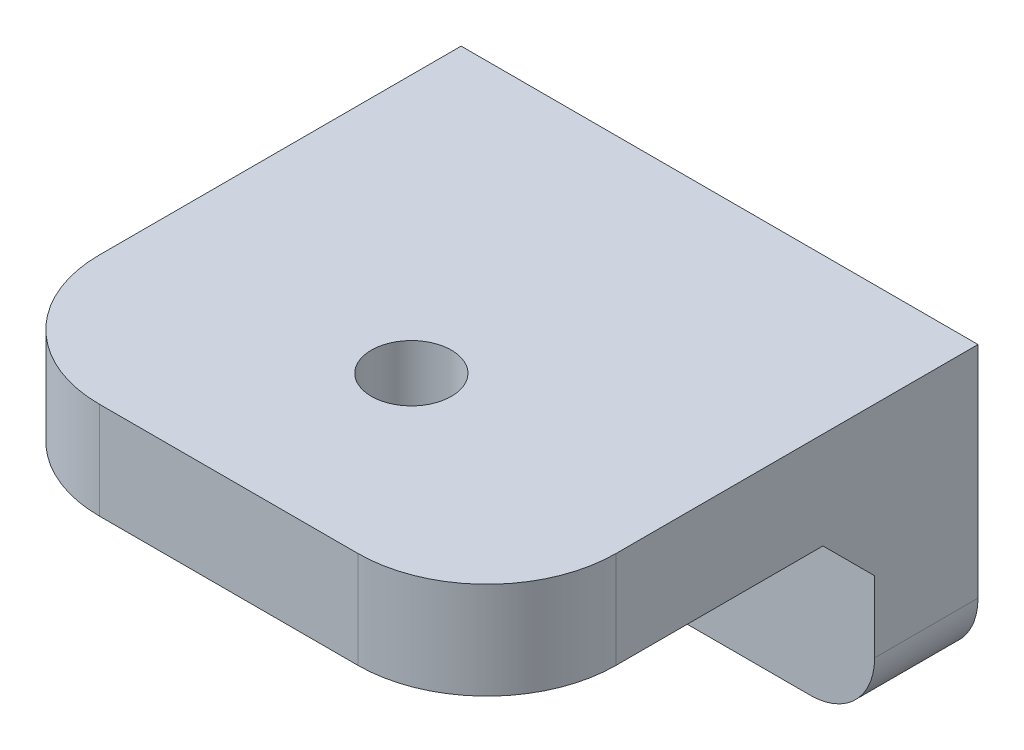
from build123d import *

# Parameters (mm, degrees)
SKETCH1_W           = 40
SKETCH1_H           = 22
BOSS_EXTRUDE1_DEPTH = 8
SKETCH2_W           = 40
SKETCH2_H           = 7.5
BOSS_EXTRUDE2_DEPTH = 30
CHAMFER1_SIZE       = 4
FILLET1_R           = 10
FILLET2_R           = 5
SKETCH3_R           = 3.1
CUT_EXTRUDE1_DEPTH  = 49.249352327


with BuildPart() as part:
    # Sketch1 → Boss-Extrude1 (new body)
    with BuildSketch(Plane.XY):
        with Locations((0, -15.406470283)):
            Rectangle(SKETCH1_W, SKETCH1_H)
    extrude(amount=BOSS_EXTRUDE1_DEPTH)

    # Sketch2 → Boss-Extrude2 (add)
    with BuildSketch(Plane.XY.offset(8)):
        with Locations((0, -8.156470283)):
            Rectangle(SKETCH2_W, SKETCH2_H)
    extrude(amount=BOSS_EXTRUDE2_DEPTH)

    # Chamfer1
    chamfer1_edges = [part.edges().sort_by_distance(p)[0] for p in [
        (0, -11.906470283, 8),
    ]]
    chamfer(chamfer1_edges, length=CHAMFER1_SIZE)

    # Fillet1
    fillet1_edges = [part.edges().sort_by_distance(p)[0] for p in [
        (-20, -8.156470283, 38),
        (20, -8.156470283, 38),
    ]]
    fillet(fillet1_edges, radius=FILLET1_R)

    # Fillet2
    fillet2_edges = [part.edges().sort_by_distance(p)[0] for p in [
        (20, -26.406470283, 4),
        (-20, -26.406470283, 4),
    ]]
    fillet(fillet2_edges, radius=FILLET2_R)

    # Sketch3 → Cut-Extrude1 (cut, through all)
    with BuildSketch(Plane(origin=(0, -4.406470283, 0), x_dir=(1, 0, 0), z_dir=(0, 1, 0))):
        with Locations(Location((0, -23.851791769, 0), (0, 0, 270))):
            Circle(SKETCH3_R)
    extrude(amount=-CUT_EXTRUDE1_DEPTH, mode=Mode.SUBTRACT)


solid = part.part
